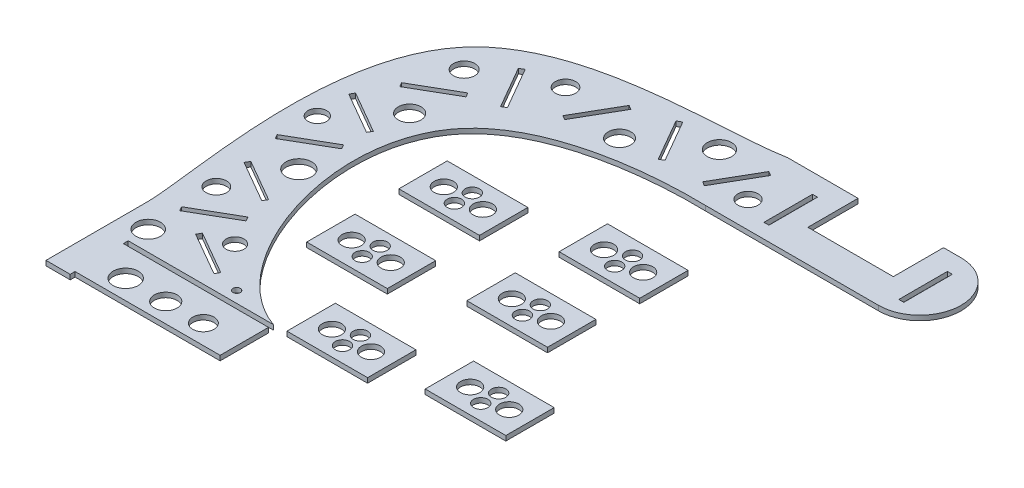
from build123d import *

# Parameters (mm, degrees)
SKETCH_1_R        = 6.307956791
SKETCH_1_R_2      = 7.020491009
SKETCH_1_R_3      = 7.54578466
SKETCH_1_R_4      = 6.192697753
SKETCH_1_R_5      = 6.579197905
SKETCH_1_R_6      = 7.065741655
SKETCH_1_R_7      = 5.798353608
SKETCH_1_R_8      = 7.976738003
SKETCH_1_R_9      = 6.335183218
SKETCH_1_R_10     = 5.525894517
SKETCH_1_R_11     = 7.595219817
SKETCH_1_R_12     = 6.576841008
SKETCH_1_R_13     = 7.772600683
SKETCH_1_R_14     = 7.066029441
SKETCH_1_R_15     = 2.271602558
SKETCH_1_W        = 3.1
SKETCH_1_H        = 30.1
EXTRUDE_1_DEPTH   = 3
SKETCH_1_W_2      = 50
SKETCH_1_H_2      = 30
SKETCH_1_R_16     = 5.97446982
SKETCH_1_R_17     = 4.469137465
EXTRUDE_1_2_DEPTH = 3
EXTRUDE_1_3_DEPTH = 3
EXTRUDE_1_4_DEPTH = 3
EXTRUDE_1_5_DEPTH = 3
EXTRUDE_1_6_DEPTH = 3
EXTRUDE_1_7_DEPTH = 3


with BuildPart() as part:
    # 草图1 → 凸台-拉伸1 (new body)
    with BuildSketch(Plane(origin=(0, 0, 0), x_dir=(1, 0, 0), z_dir=(0, 1, 0))):
        with BuildLine():
            Line((5.247011952, -15.051792829), (5.247011952, -12.051792829))
            Line((5.247011952, -12.051792829), (95.247011952, -12.051792829))
            Line((95.247011952, -12.051792829), (95.247011952, 17.948207171))
            Line((95.247011952, 17.948207171), (5.247011952, 17.948207171))
            Line((5.247011952, 17.948207171), (5.247011952, 20.948207171))
            Line((5.247011952, 20.948207171), (55.247011952, 20.948207171))
            Line((55.247011952, 20.948207171), (95.247011952, 20.948207171))
            add(Edge.make_bspline(
                [(165.197049135, 218.948207171), (131.683023816, 219.791470419), (-12.948667628, 207.340209855), (45.143832663, 38.717004591), (95.247011952, 20.948207171)],
                knots=[0, 0, 0, 0, 0.406592359, 1, 1, 1, 1], degree=3))
            Line((165.197049135, 218.948207171), (208.747011952, 218.948207171))
            Line((208.747011952, 218.948207171), (261.747011952, 218.948207171))
            Line((261.747011952, 218.948207171), (272.60461602, 218.948207171))
            ThreePointArc((272.60461602, 218.948207171), (298.171172706, 244.514763857), (272.60461602, 270.081320543))
            Line((272.60461602, 270.081320543), (261.747011952, 270.081320543))
            Line((261.747011952, 270.081320543), (261.747011952, 238.948207171))
            Line((261.747011952, 238.948207171), (208.747011952, 238.948207171))
            Line((208.747011952, 238.948207171), (208.747011952, 270.081320543))
            Line((208.747011952, 270.081320543), (165.197049135, 270.081320543))
            add(Edge.make_bspline(
                [(165.197049135, 270.081320543), (127.169908769, 262.985262899), (-54.163610973, 278.312781016), (-10.68913353, 80.196037333), (-9.752988048, 48.938035839)],
                knots=[0, 0, 0, 0, 0.477547402, 1, 1, 1, 1], degree=3))
            Line((-9.752988048, 48.938035839), (-9.752988048, -15.051792829))
            Line((-9.752988048, -15.051792829), (5.247011952, -15.051792829))
        make_face()
        with Locations(Location((58.436147908, 238.948207171, 0), (0, 0, 270))):
            Circle(SKETCH_1_R, mode=Mode.SUBTRACT)
        with Locations(Location((102.552638427, 228.328787529, 0), (0, 0, 270))):
            Circle(SKETCH_1_R_2, mode=Mode.SUBTRACT)
        with Locations(Location((139.578978684, 253.291530078, 0), (0, 0, 270))):
            Circle(SKETCH_1_R_3, mode=Mode.SUBTRACT)
        with Locations(Location((175.226678611, 235.349278539, 0), (0, 0, 270))):
            Circle(SKETCH_1_R_4, mode=Mode.SUBTRACT)
        with Locations(Location((17.470835284, 217.052984295, 0), (0, 0, 270))):
            Circle(SKETCH_1_R_5, mode=Mode.SUBTRACT)
        with Locations(Location((24.050033189, 176.678517526, 0), (0, 0, 270))):
            Circle(SKETCH_1_R_6, mode=Mode.SUBTRACT)
        with Locations(Location((-3.16367364, 146.636228702, 0), (0, 0, 270))):
            Circle(SKETCH_1_R_7, mode=Mode.SUBTRACT)
        with Locations(Location((19.709197985, 112.309727874, 0), (0, 0, 270))):
            Circle(SKETCH_1_R_8, mode=Mode.SUBTRACT)
        with Locations(Location((3.52738854, 77.294623962, 0), (0, 0, 270))):
            Circle(SKETCH_1_R_9, mode=Mode.SUBTRACT)
        with Locations(Location((40.112540519, 52.319320603, 0), (0, 0, 270))):
            Circle(SKETCH_1_R_10, mode=Mode.SUBTRACT)
        with Locations(Location((5.247011952, 33.355902147, 0), (0, 0, 270))):
            Circle(SKETCH_1_R_11, mode=Mode.SUBTRACT)
        with Locations(Location((72.795206144, 0, 0), (0, 0, 270))):
            Circle(SKETCH_1_R_12, mode=Mode.SUBTRACT)
        with Locations(Location((24.601575374, 0, 0), (0, 0, 270))):
            Circle(SKETCH_1_R_13, mode=Mode.SUBTRACT)
        with Locations(Location((49.448362892, 0, 0), (0, 0, 270))):
            Circle(SKETCH_1_R_14, mode=Mode.SUBTRACT)
        with Locations(Location((65.53881945, 27.919023937, 0), (0, 0, 270))):
            Circle(SKETCH_1_R_15, mode=Mode.SUBTRACT)
        with Locations((194.000119697, 243.057275333)):
            Rectangle(SKETCH_1_W, SKETCH_1_H, mode=Mode.SUBTRACT)
        with Locations((277.256003407, 243.448758848)):
            Rectangle(SKETCH_1_W, SKETCH_1_H, mode=Mode.SUBTRACT)
        Polygon((169.395621339, 255.257558354), (166.710942587, 256.807558354), (151.660942587, 230.7401937), (154.345621339, 229.1901937), align=None, mode=Mode.SUBTRACT)
        Polygon((90.529884896, 247.44089309), (87.845206144, 248.99089309), (72.795206144, 222.923528436), (75.479884896, 221.373528436), align=None, mode=Mode.SUBTRACT)
        Polygon((113.414721713, 256.725575047), (110.730042961, 255.175575047), (125.780042961, 229.108210393), (128.464721713, 230.658210393), align=None, mode=Mode.SUBTRACT)
        Polygon((36.26466332, 236.10832497), (33.579984568, 234.55832497), (48.629984568, 208.490960316), (51.31466332, 210.040960316), align=None, mode=Mode.SUBTRACT)
        Polygon((0.612688539, 101.627575932), (-0.937311461, 98.94289718), (25.130053193, 83.89289718), (26.680053193, 86.577575932), align=None, mode=Mode.SUBTRACT)
        Polygon((-3.61367364, 170.813359438), (-5.16367364, 168.128680686), (20.903691014, 153.078680686), (22.453691014, 155.763359438), align=None, mode=Mode.SUBTRACT)
        Polygon((31.144753194, 68.148743467), (29.594753194, 70.833422219), (3.52738854, 55.783422219), (5.07738854, 53.098743467), align=None, mode=Mode.SUBTRACT)
        Polygon((22.018096677, 136.537744355), (20.468096677, 139.222423107), (-5.599267977, 124.172423107), (-4.049267977, 121.487744355), align=None, mode=Mode.SUBTRACT)
        Polygon((32.697701156, 202.993094468), (31.147701156, 205.677773219), (5.080336502, 190.627773219), (6.630336502, 187.943094468), align=None, mode=Mode.SUBTRACT)
        Polygon((24.151575374, 48.076479283), (22.601575374, 45.391800532), (49.448362892, 29.891800532), (50.998362892, 32.576479283), align=None, mode=Mode.SUBTRACT)
    extrude(amount=EXTRUDE_1_DEPTH)


with BuildPart() as body_2:
    # 草图1 → Extrude 1 2 (new body)
    with BuildSketch(Plane(origin=(0, 0, 0), x_dir=(1, 0, 0), z_dir=(0, 1, 0))):
        with Locations((169.722427014, 163.697751212)):
            Rectangle(SKETCH_1_W_2, SKETCH_1_H_2)
        with Locations(Location((181.837604454, 163.697751212, 0), (0, 0, 270))):
            Circle(SKETCH_1_R_16, mode=Mode.SUBTRACT)
        with Locations(Location((169.722427014, 169.258689113, 0), (0, 0, 270))):
            Circle(SKETCH_1_R_17, mode=Mode.SUBTRACT)
        with Locations(Location((157.607249574, 163.697751212, 0), (0, 0, 270))):
            Circle(SKETCH_1_R_16, mode=Mode.SUBTRACT)
        with Locations(Location((169.722427014, 158.136813312, 0), (0, 0, 270))):
            Circle(SKETCH_1_R_17, mode=Mode.SUBTRACT)
    extrude(amount=EXTRUDE_1_2_DEPTH)


with BuildPart() as body_3:
    # 草图1 → Extrude 1 3 (new body)
    with BuildSketch(Plane(origin=(0, 0, 0), x_dir=(1, 0, 0), z_dir=(0, 1, 0))):
        with Locations((167.443871431, 108.775322761)):
            Rectangle(SKETCH_1_W_2, SKETCH_1_H_2)
        with Locations(Location((179.559048871, 108.775322761, 0), (0, 0, 270))):
            Circle(SKETCH_1_R_16, mode=Mode.SUBTRACT)
        with Locations(Location((167.443871431, 114.336260661, 0), (0, 0, 270))):
            Circle(SKETCH_1_R_17, mode=Mode.SUBTRACT)
        with Locations(Location((155.32869399, 108.775322761, 0), (0, 0, 270))):
            Circle(SKETCH_1_R_16, mode=Mode.SUBTRACT)
        with Locations(Location((167.443871431, 103.21438486, 0), (0, 0, 270))):
            Circle(SKETCH_1_R_17, mode=Mode.SUBTRACT)
    extrude(amount=EXTRUDE_1_3_DEPTH)


with BuildPart() as body_4:
    # 草图1 → Extrude 1 4 (new body)
    with BuildSketch(Plane(origin=(0, 0, 0), x_dir=(1, 0, 0), z_dir=(0, 1, 0))):
        with Locations((86.247072985, 147.786075087)):
            Rectangle(SKETCH_1_W_2, SKETCH_1_H_2)
        with Locations(Location((98.362250425, 147.786075087, 0), (0, 0, 270))):
            Circle(SKETCH_1_R_16, mode=Mode.SUBTRACT)
        with Locations(Location((86.247072985, 153.347012988, 0), (0, 0, 270))):
            Circle(SKETCH_1_R_17, mode=Mode.SUBTRACT)
        with Locations(Location((74.131895544, 147.786075087, 0), (0, 0, 270))):
            Circle(SKETCH_1_R_16, mode=Mode.SUBTRACT)
        with Locations(Location((86.247072985, 142.225137186, 0), (0, 0, 270))):
            Circle(SKETCH_1_R_17, mode=Mode.SUBTRACT)
    extrude(amount=EXTRUDE_1_4_DEPTH)


with BuildPart() as body_5:
    # 草图1 → Extrude 1 5 (new body)
    with BuildSketch(Plane(origin=(0, 0, 0), x_dir=(1, 0, 0), z_dir=(0, 1, 0))):
        with Locations((86.247072985, 90.630786795)):
            Rectangle(SKETCH_1_W_2, SKETCH_1_H_2)
        with Locations(Location((98.362250425, 90.630786795, 0), (0, 0, 270))):
            Circle(SKETCH_1_R_16, mode=Mode.SUBTRACT)
        with Locations(Location((86.247072985, 96.191724696, 0), (0, 0, 270))):
            Circle(SKETCH_1_R_17, mode=Mode.SUBTRACT)
        with Locations(Location((74.131895544, 90.630786795, 0), (0, 0, 270))):
            Circle(SKETCH_1_R_16, mode=Mode.SUBTRACT)
        with Locations(Location((86.247072985, 85.069848894, 0), (0, 0, 270))):
            Circle(SKETCH_1_R_17, mode=Mode.SUBTRACT)
    extrude(amount=EXTRUDE_1_5_DEPTH)


with BuildPart() as body_6:
    # 草图1 → Extrude 1 6 (new body)
    with BuildSketch(Plane(origin=(0, 0, 0), x_dir=(1, 0, 0), z_dir=(0, 1, 0))):
        with Locations((127.979505706, 36.650792297)):
            Rectangle(SKETCH_1_W_2, SKETCH_1_H_2)
        with Locations(Location((140.094683146, 36.650792297, 0), (0, 0, 270))):
            Circle(SKETCH_1_R_16, mode=Mode.SUBTRACT)
        with Locations(Location((127.979505706, 42.211730198, 0), (0, 0, 270))):
            Circle(SKETCH_1_R_17, mode=Mode.SUBTRACT)
        with Locations(Location((115.864328265, 36.650792297, 0), (0, 0, 270))):
            Circle(SKETCH_1_R_16, mode=Mode.SUBTRACT)
        with Locations(Location((127.979505706, 31.089854397, 0), (0, 0, 270))):
            Circle(SKETCH_1_R_17, mode=Mode.SUBTRACT)
    extrude(amount=EXTRUDE_1_6_DEPTH)


with BuildPart() as body_7:
    # 草图1 → Extrude 1 7 (new body)
    with BuildSketch(Plane(origin=(0, 0, 0), x_dir=(1, 0, 0), z_dir=(0, 1, 0))):
        with Locations((201.918489765, 48.444740675)):
            Rectangle(SKETCH_1_W_2, SKETCH_1_H_2)
        with Locations(Location((214.033667206, 48.444740675, 0), (0, 0, 270))):
            Circle(SKETCH_1_R_16, mode=Mode.SUBTRACT)
        with Locations(Location((201.918489765, 54.005678576, 0), (0, 0, 270))):
            Circle(SKETCH_1_R_17, mode=Mode.SUBTRACT)
        with Locations(Location((189.803312325, 48.444740675, 0), (0, 0, 270))):
            Circle(SKETCH_1_R_16, mode=Mode.SUBTRACT)
        with Locations(Location((201.918489765, 42.883802774, 0), (0, 0, 270))):
            Circle(SKETCH_1_R_17, mode=Mode.SUBTRACT)
    extrude(amount=EXTRUDE_1_7_DEPTH)


solid = Compound([part.part, body_2.part, body_3.part, body_4.part, body_5.part, body_6.part, body_7.part])
